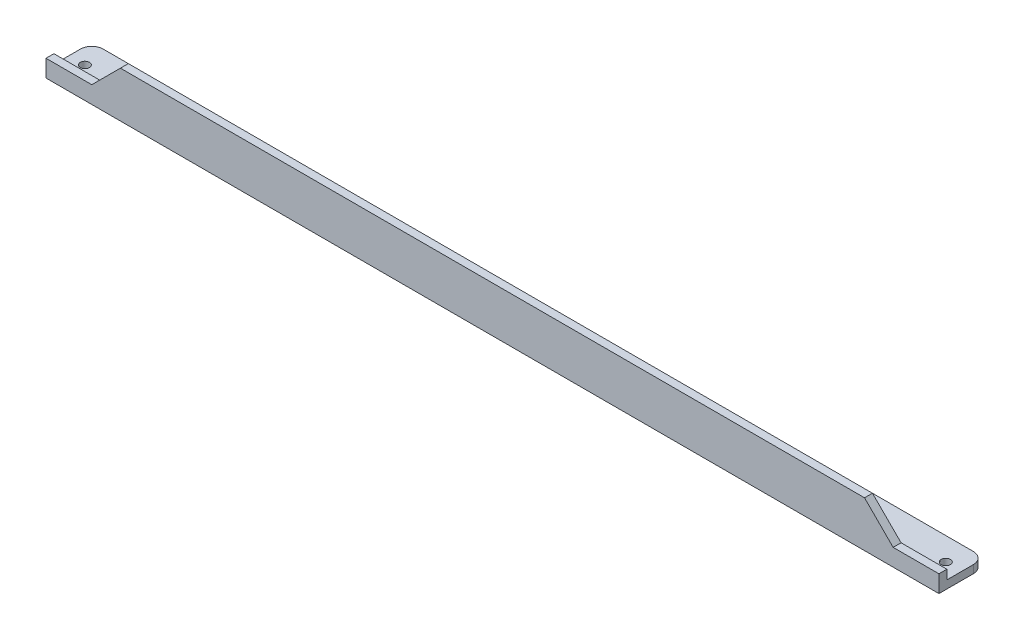
from build123d import *

# Parameters (mm, degrees)
BOSS_EXTRUDE1_DEPTH = 390
SKETCH2_R           = 2
CUT_EXTRUDE1_DEPTH  = 392.02429592
CUT_EXTRUDE2_DEPTH  = 392.02429592
FILLET1_R           = 5


with BuildPart() as part:
    # Sketch1 → Boss-Extrude1 (new body)
    with BuildSketch(Plane(origin=(0, 0, 0), x_dir=(0, 0, -1), z_dir=(1, 0, 0))):
        Polygon((0, 0), (20, 0), (20, 3.461178467), (3.461178467, 3.461178467), (3.461178467, 20), (0, 20), align=None)
    extrude(amount=BOSS_EXTRUDE1_DEPTH)

    # Sketch2 → Cut-Extrude1 (cut, through all)
    with BuildSketch(Plane.XZ):
        with Locations(Location((195, -10, 0), (0, 0, 270))):
            Circle(SKETCH2_R)
        with Locations(Location((335, -10, 0), (0, 0, 270))):
            Circle(SKETCH2_R)
        with Locations(Location((55, -10, 0), (0, 0, 270))):
            Circle(SKETCH2_R)
        with Locations(Location((383, -10, 0), (0, 0, 270))):
            Circle(SKETCH2_R)
        with Locations(Location((7, -10, 0), (0, 0, 270))):
            Circle(SKETCH2_R)
    extrude(amount=-CUT_EXTRUDE1_DEPTH, mode=Mode.SUBTRACT)

    # Sketch3 → Cut-Extrude2 (cut, through all)
    with BuildSketch(Plane.XY):
        Polygon((0, 7.5), (20, 7.5), (32.5, 20), (0, 20), align=None)
        Polygon((390, 20), (357.5, 20), (370, 7.5), (390, 7.5), align=None)
    extrude(amount=-CUT_EXTRUDE2_DEPTH, mode=Mode.SUBTRACT)

    # Fillet1
    fillet1_edges = [part.edges().sort_by_distance(p)[0] for p in [
        (390, 1.730589234, -20),
        (0, 1.730589234, -20),
    ]]
    fillet(fillet1_edges, radius=FILLET1_R)


solid = part.part
